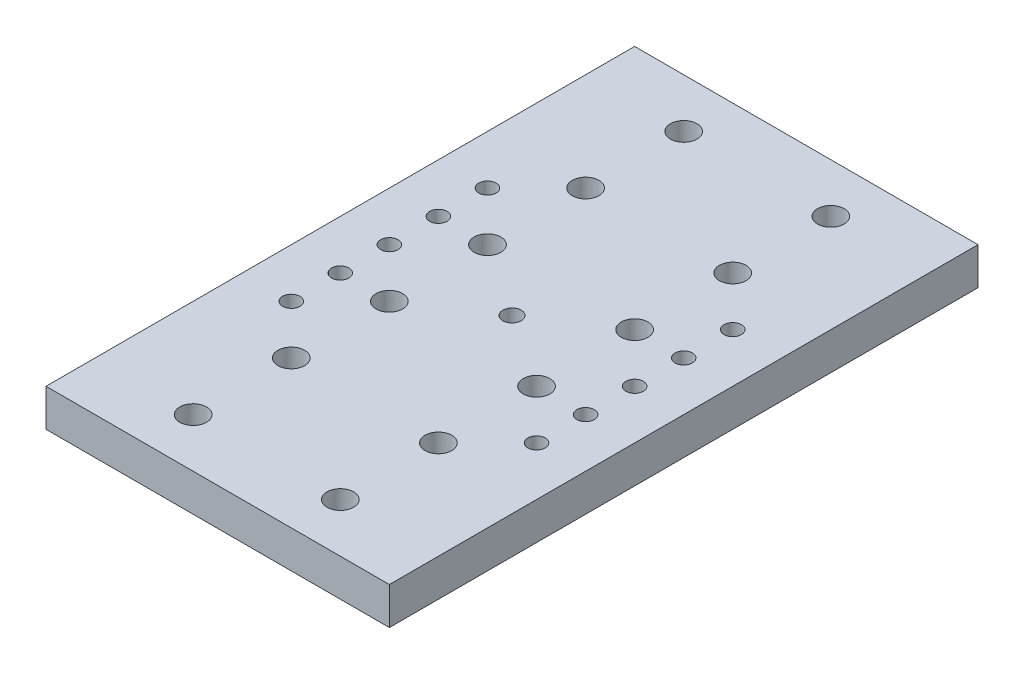
from build123d import *

# Parameters (mm, degrees)
SKETCH1_W                = 88.9
SKETCH1_H                = 152.4
SKETCH1_R                = 2.38125
BOSS_EXTRUDE1_DEPTH      = 9.652
F_5_16_24_TAPPED_HOLE1_D = 6.9088
F_12_24_TAPPED_HOLE1_D   = 4.4958


with BuildPart() as part:
    # Sketch1 → Boss-Extrude1 (new body)
    with BuildSketch(Plane(origin=(0, 0, 0), x_dir=(1, 0, 0), z_dir=(0, 1, 0))):
        Rectangle(SKETCH1_W, SKETCH1_H)
        with Locations(Location((0, 0, 0), (0, 0, 270))):
            Circle(SKETCH1_R, mode=Mode.SUBTRACT)
    extrude(amount=BOSS_EXTRUDE1_DEPTH)

    # 5/16-24 Tapped Hole1 (through all)
    with Locations(Plane(origin=(0, 9.652, 0), x_dir=(1, 0, 0), z_dir=(0, 1, 0))):
        with Locations((19.05, 63.5), (-19.05, 63.5), (-19.05, 38.1), (19.05, 38.1), (19.05, 12.7), (19.05, -12.7), (19.05, -38.1), (19.05, -63.5), (-19.05, 12.7), (-19.05, -12.7), (-19.05, -38.1), (-19.05, -63.5)):
            Hole(F_5_16_24_TAPPED_HOLE1_D / 2)

    # #12-24 Tapped Hole1 (through all)
    with Locations(Plane(origin=(0, 9.652, 0), x_dir=(1, 0, 0), z_dir=(0, 1, 0))):
        with Locations((-31.75, 0), (31.75, 0), (-31.75, 12.7), (-31.75, 25.4), (31.75, 25.4), (31.75, 12.7), (31.75, -12.7), (31.75, -25.4), (-31.75, -12.7), (-31.75, -25.4)):
            Hole(F_12_24_TAPPED_HOLE1_D / 2)


solid = part.part
